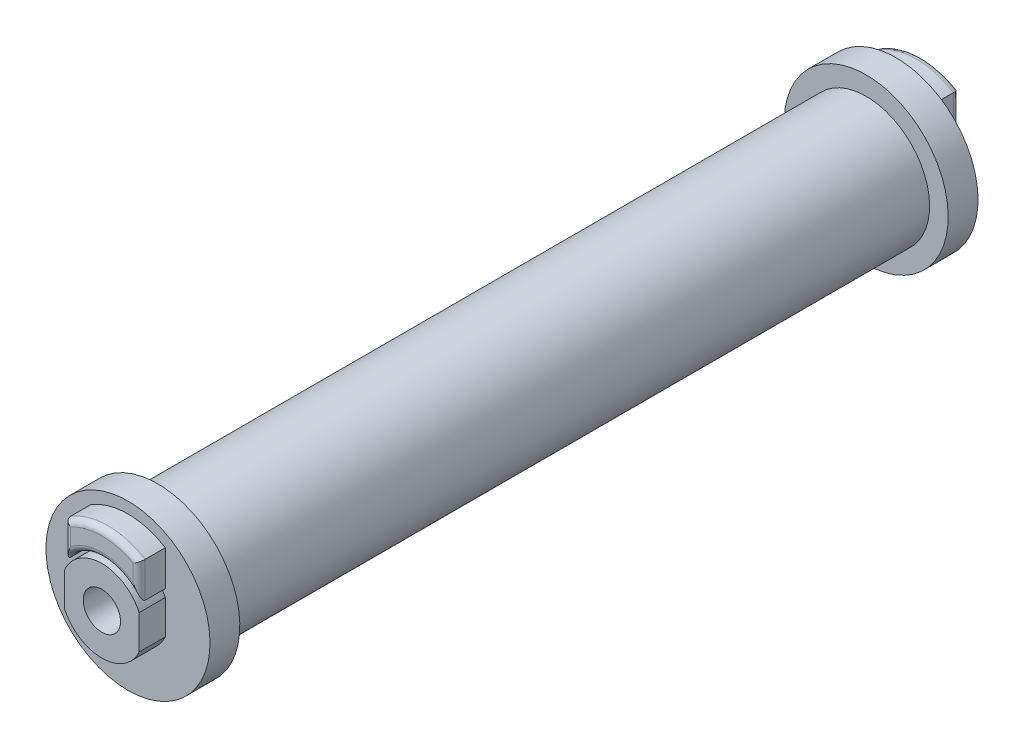
from build123d import *

# Parameters (mm, degrees)
CORTAR_EXTRUIR1_START = -3.5
CORTAR_EXTRUIR1_DEPTH = 3.5
REDONDEO1_R           = 0.8


with BuildPart() as part:
    # Croquis1 → Revolución1 (revolve)
    with BuildSketch(Plane(origin=(0, 0, 0), x_dir=(0, 0, -1), z_dir=(1, 0, 0)), mode=Mode.PRIVATE) as revoluci_n1_sk:
        Polygon((0, 2.5), (-55, 2.5), (-55, 5.5), (-51.5, 5.5), (-51.5, 6), (-55, 6), (-55, 9.5), (-51.5, 9.5), (-51.5, 11), (-47.5, 11), (-47.5, 8.5), (0, 8.5), align=None)
    revolve(revoluci_n1_sk.sketch.rotate(Axis((0, 0, 58.146951639), (0, 0, -1)), 180), axis=Axis((0, 0, 58.146951639), (0, 0, -1)))

    # Croquis2 → Cortar-Extruir1 (cut)
    with BuildSketch(Plane.XY.offset(55).offset(CORTAR_EXTRUIR1_START)):
        with BuildLine():
            Line((-5, 0), (-5, 8.077747211))
            ThreePointArc((-5, 8.077747211), (0, -9.5), (5, 8.077747211))
            Line((5, 8.077747211), (5, 0))
            Line((5, 0), (5, -2.291287847))
            ThreePointArc((5, -2.291287847), (0, -5.5), (-5, -2.291287847))
            Line((-5, -2.291287847), (-5, 0))
        make_face()
    extrude(amount=CORTAR_EXTRUIR1_DEPTH, mode=Mode.SUBTRACT)

    # Redondeo1
    redondeo1_edges = [part.edges().sort_by_distance(p)[0] for p in [
        (0, 9.5, 55),
        (0, 6, 55),
        (5, 5.697186001, 55),
        (-5, 5.697186001, 55),
    ]]
    fillet(redondeo1_edges, radius=REDONDEO1_R)

    # Simetría1: part across plane


with BuildPart() as part_1:
    add(part.part)
    add(part.part.mirror(Plane.XY))


solid = part_1.part
